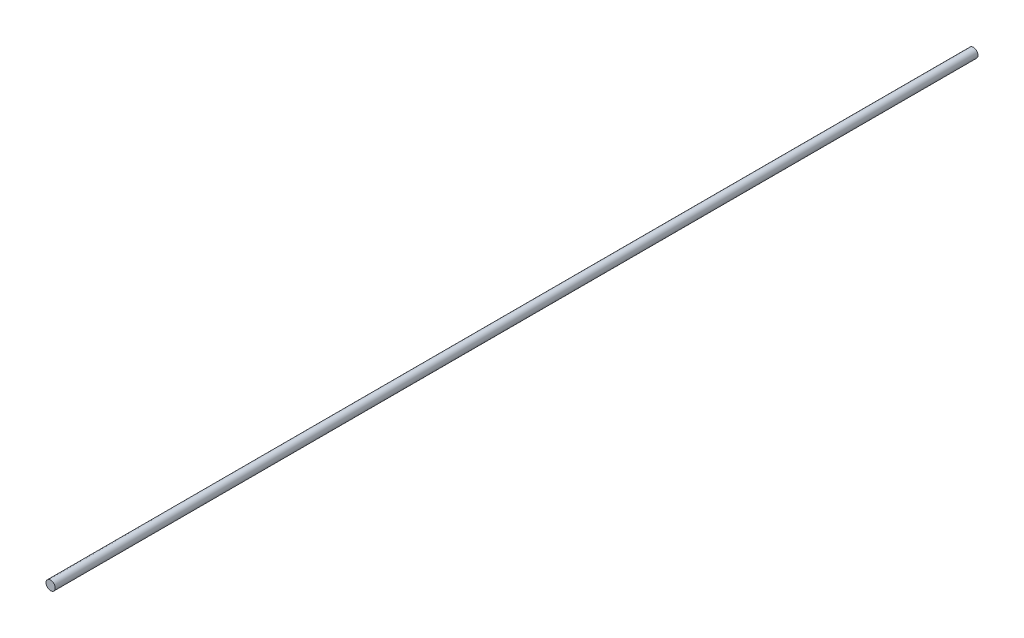
from build123d import *

# Parameters (mm, degrees)
ESQUISSE1_R        = 2.5
BOSS_EXTRU_1_DEPTH = 500


with BuildPart() as part:
    # Esquisse1 → Boss.-Extru.1 (new body)
    with BuildSketch(Plane.XY):
        Circle(ESQUISSE1_R)
    extrude(amount=BOSS_EXTRU_1_DEPTH)


solid = part.part
